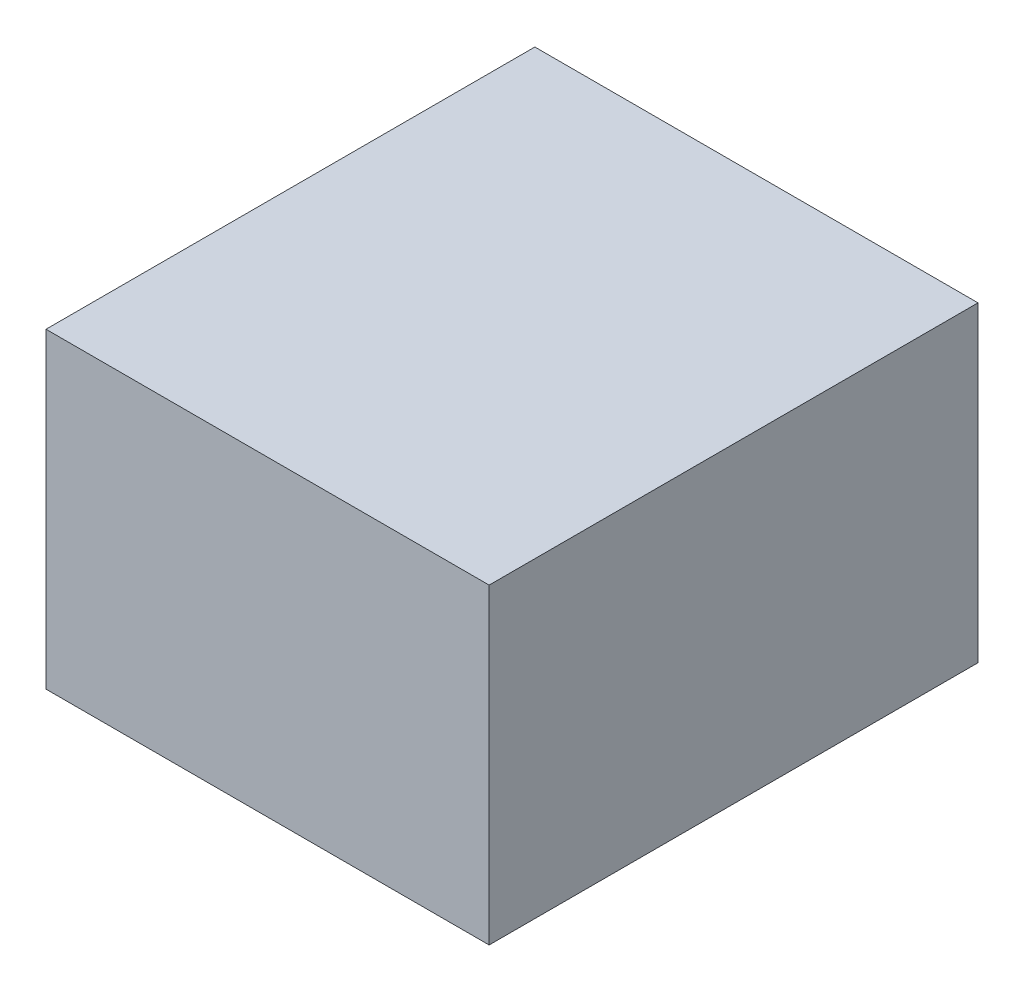
from build123d import *

# Parameters (mm, degrees)
SKETCH1_W           = 2.843438621
SKETCH1_H           = 3.136759372
BOSS_EXTRUDE1_DEPTH = 2


with BuildPart() as part:
    # Sketch1 → Boss-Extrude1 (new body)
    with BuildSketch(Plane(origin=(0, 0, 0), x_dir=(1, 0, 0), z_dir=(0, 1, 0))):
        with Locations((1.421719311, -1.568379686)):
            Rectangle(SKETCH1_W, SKETCH1_H)
    extrude(amount=BOSS_EXTRUDE1_DEPTH)


solid = part.part
